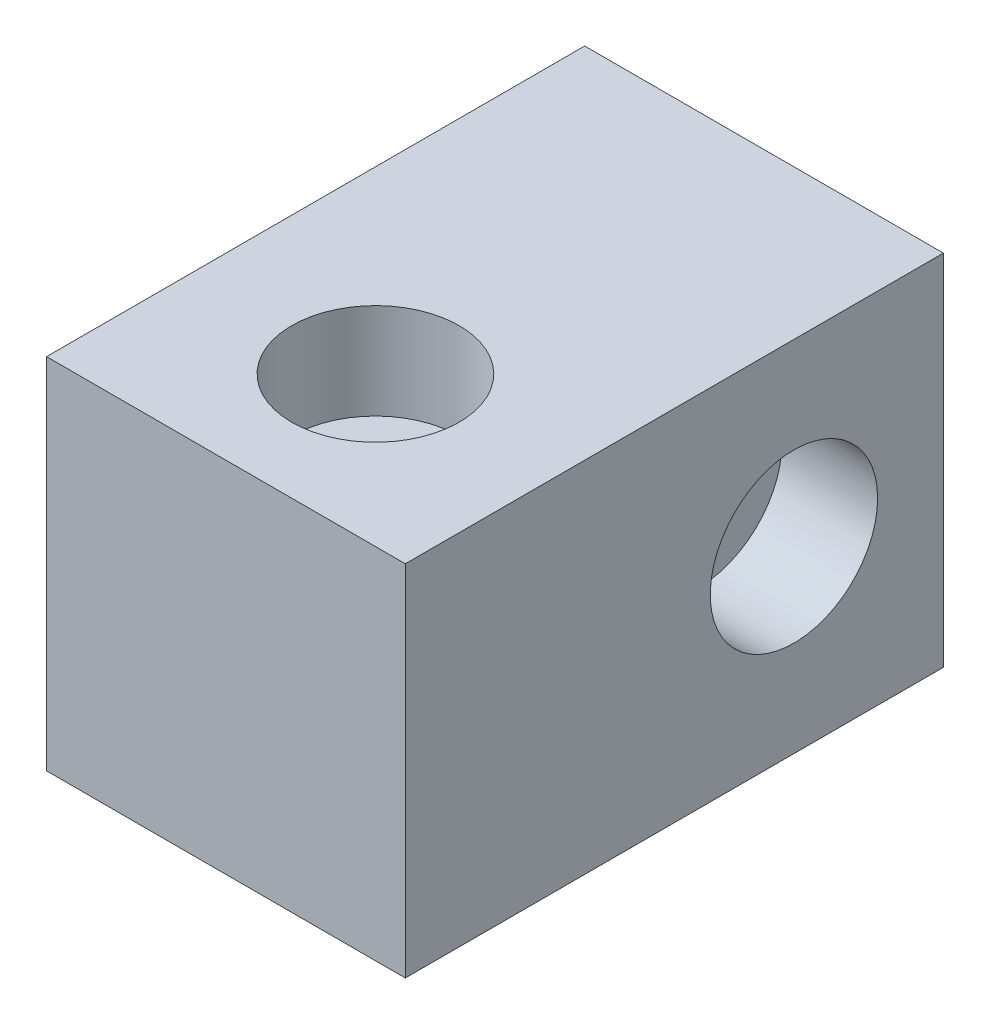
from build123d import *

# Parameters (mm, degrees)
SKETCH1_W           = 15
SKETCH1_H           = 22.5
BOSS_EXTRUDE1_DEPTH = 15
SKETCH2_R           = 2
CUT_EXTRUDE1_DEPTH  = 31.923292192
SKETCH3_R           = 2
CUT_EXTRUDE2_DEPTH  = 31.923292192
SKETCH4_R           = 3.5
CUT_EXTRUDE3_DEPTH  = 4
SKETCH5_R           = 3.5
CUT_EXTRUDE4_DEPTH  = 4


with BuildPart() as part:
    # Sketch1 → Boss-Extrude1 (new body)
    with BuildSketch(Plane(origin=(0, 0, 0), x_dir=(1, 0, 0), z_dir=(0, 1, 0))):
        with Locations((7.5, 11.25)):
            Rectangle(SKETCH1_W, SKETCH1_H)
    extrude(amount=BOSS_EXTRUDE1_DEPTH)

    # Sketch2 → Cut-Extrude1 (cut, through all)
    with BuildSketch(Plane(origin=(0, 15, 0), x_dir=(1, 0, 0), z_dir=(0, 1, 0))):
        with Locations(Location((7.5, 6.25, 0), (0, 0, 270))):
            Circle(SKETCH2_R)
    extrude(amount=-CUT_EXTRUDE1_DEPTH, mode=Mode.SUBTRACT)

    # Sketch3 → Cut-Extrude2 (cut, through all)
    with BuildSketch(Plane.ZY):
        with Locations((-16.25, 7.5)):
            Circle(SKETCH3_R)
    extrude(amount=-CUT_EXTRUDE2_DEPTH, mode=Mode.SUBTRACT)

    # Sketch4 → Cut-Extrude3 (cut)
    with BuildSketch(Plane(origin=(0, 15, 0), x_dir=(1, 0, 0), z_dir=(0, 1, 0))):
        with Locations(Location((7.5, 6.25, 0), (0, 0, 270))):
            Circle(SKETCH4_R)
    extrude(amount=-CUT_EXTRUDE3_DEPTH, mode=Mode.SUBTRACT)

    # Sketch5 → Cut-Extrude4 (cut)
    with BuildSketch(Plane(origin=(15, 0, 0), x_dir=(0, 0, -1), z_dir=(1, 0, 0))):
        with Locations((16.25, 7.5)):
            Circle(SKETCH5_R)
    extrude(amount=-CUT_EXTRUDE4_DEPTH, mode=Mode.SUBTRACT)


solid = part.part
